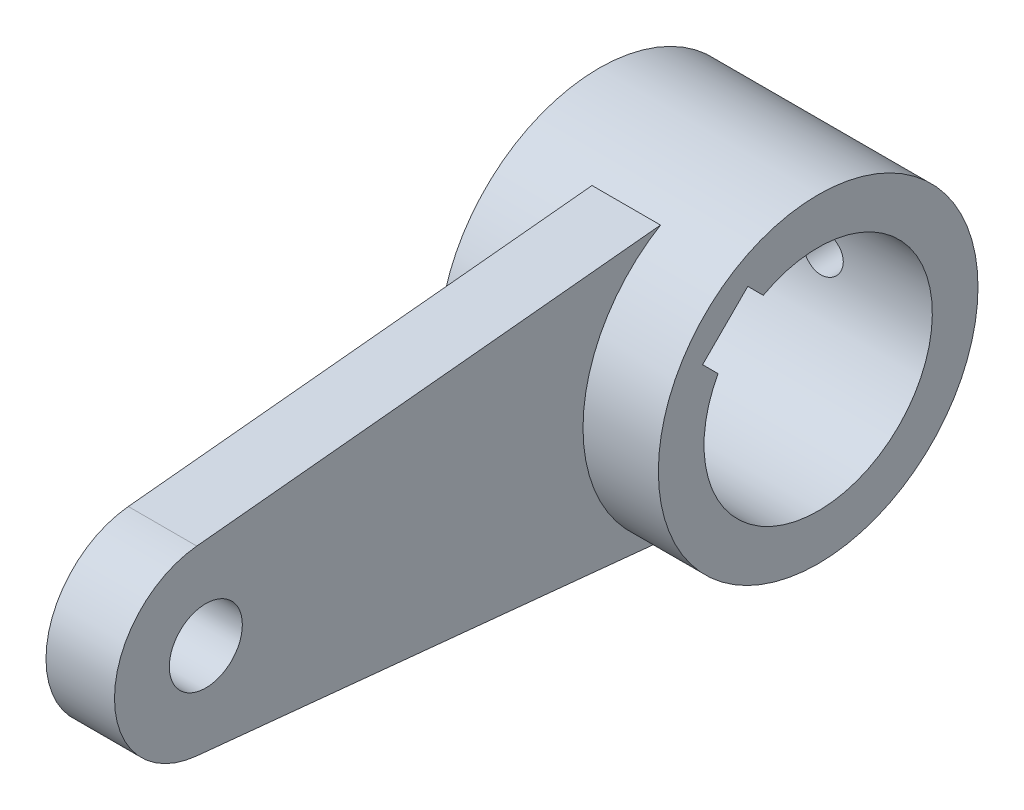
from build123d import *

# Parameters (mm, degrees)
SKETCH1_R           = 35
SKETCH1_R_2         = 25
BOSS_EXTRUDE1_DEPTH = 24
BOSS_EXTRUDE2_DEPTH = 7.5
SKETCH3_R           = 8
CUT_EXTRUDE1_DEPTH  = 15
CUT_EXTRUDE2_DEPTH  = 150.875815261
SKETCH6_R           = 4.5
CUT_EXTRUDE3_DEPTH  = 24


with BuildPart() as part:
    # Sketch1 → Boss-Extrude1 (new, symmetric)
    with BuildSketch(Plane(origin=(0, 0, 0), x_dir=(0, 0, -1), z_dir=(1, 0, 0))):
        Circle(SKETCH1_R)
        Circle(SKETCH1_R_2, mode=Mode.SUBTRACT)
    extrude(amount=BOSS_EXTRUDE1_DEPTH, both=True)

    # Sketch2 → Boss-Extrude2 (add, symmetric)
    with BuildSketch(Plane(origin=(0, 0, 0), x_dir=(0, 0, -1), z_dir=(1, 0, 0))):
        with BuildLine():
            Line((-18.027756377, 30), (-119.579019246, 19.901846216))
            ThreePointArc((-119.579019246, 19.901846216), (-137.6, 0), (-119.579019246, -19.901846216))
            Line((-119.579019246, -19.901846216), (-18.027756377, -30))
            ThreePointArc((-18.027756377, -30), (-35, 0), (-18.027756377, 30))
        make_face()
    extrude(amount=BOSS_EXTRUDE2_DEPTH, both=True)

    # Sketch3 → Cut-Extrude1 (cut)
    with BuildSketch(Plane(origin=(7.5, 0, 0), x_dir=(0, 0, -1), z_dir=(1, 0, 0))):
        with Locations((-117.6, 0)):
            Circle(SKETCH3_R)
    extrude(amount=-CUT_EXTRUDE1_DEPTH, mode=Mode.SUBTRACT)

    # Sketch5 → Cut-Extrude2 (cut, through all)
    with BuildSketch(Plane(origin=(24, 0, 0), x_dir=(0, 0, -1), z_dir=(1, 0, 0))):
        Polygon((6.196638775, 3.702856162), (-15.41492783, 25.314422766), (-25.314422766, 15.41492783), (-3.702856162, -6.196638775), align=None)
    extrude(amount=-CUT_EXTRUDE2_DEPTH, mode=Mode.SUBTRACT)

    # Sketch6 → Cut-Extrude3 (cut)
    with BuildSketch(Plane.XY.offset(-35)):
        with Locations(Location((0, 0, 0), (0, 0, 180))):
            Circle(SKETCH6_R)
    extrude(amount=CUT_EXTRUDE3_DEPTH, mode=Mode.SUBTRACT)


solid = part.part
